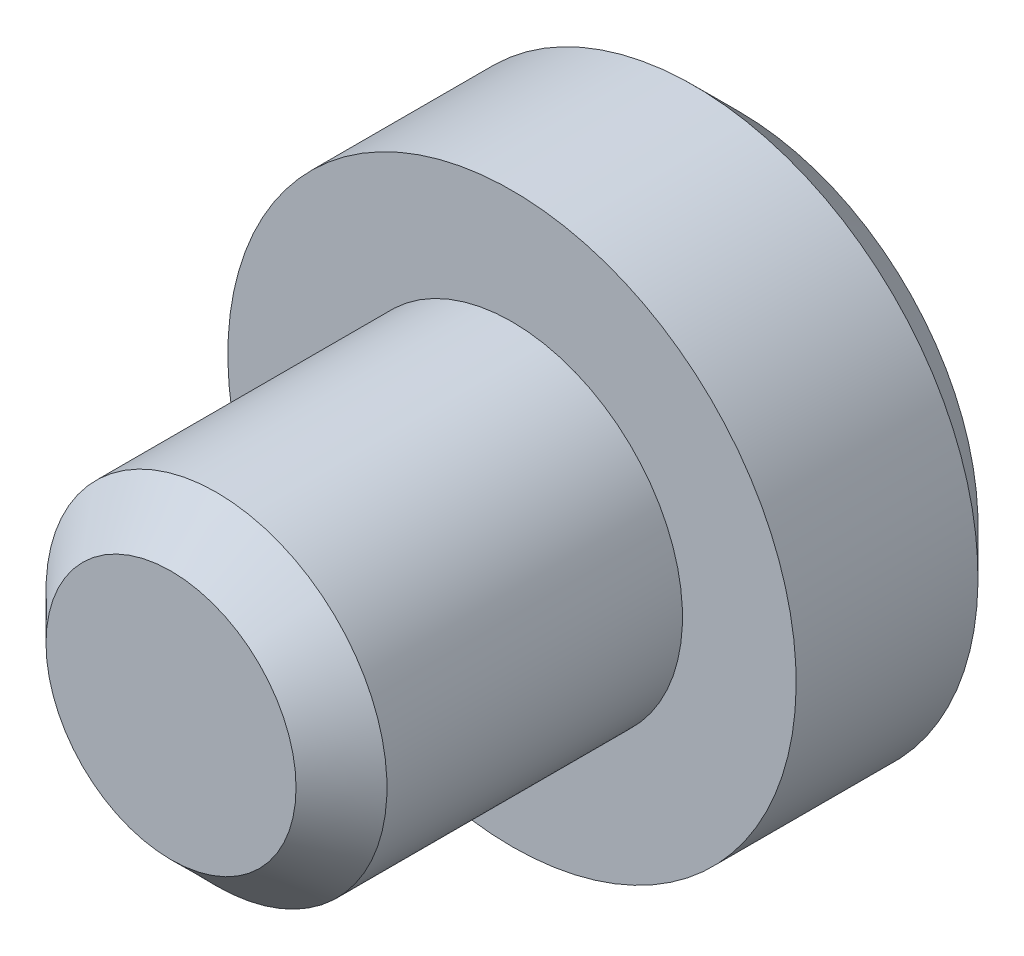
from build123d import *

# Parameters (mm, degrees)
CUT_EXTRUDE1_DEPTH = 2
CHAMFER1_SIZE      = 0.4
CHAMFER2_SIZE      = 0.1


with BuildPart() as part:
    # Sketch2 → Revolve1 (revolve)
    with BuildSketch(Plane(origin=(0, 0, 0), x_dir=(0, 0, -1), z_dir=(1, 0, 0)), mode=Mode.PRIVATE) as revolve1_sk:
        Polygon((0, 2.5), (-2, 2.5), (-2, 1.5), (-5, 1.5), (-5, 0), (0, 0), align=None)
    revolve(revolve1_sk.sketch.rotate(Axis((0, 0, 5), (0, 0, -1)), 180), axis=Axis((0, 0, 5), (0, 0, -1)))

    # Sketch3 → Cut-Extrude1 (cut)
    with BuildSketch(Plane(origin=(0, 0, 0), x_dir=(-1, 0, 0), z_dir=(0, 0, -1))):
        Polygon((1.168445951, -0.498063644), (1.015558744, 0.762872054), (-0.152887207, 1.260935698), (-1.168445951, 0.498063644), (-1.015558744, -0.762872054), (0.152887207, -1.260935698), align=None)
    extrude(amount=-CUT_EXTRUDE1_DEPTH, mode=Mode.SUBTRACT)

    # Chamfer1
    chamfer1_edges = [part.edges().sort_by_distance(p)[0] for p in [
        (0, 1.5, 5),
        (0, 2.5, 0),
    ]]
    chamfer(chamfer1_edges, length=CHAMFER1_SIZE)

    # Chamfer2
    chamfer2_edges = [part.edges().sort_by_distance(p)[0] for p in [
        (-0.660666579, -0.879499671, 0),
        (-1.092002347, 0.132404205, 0),
        (-0.431335769, 1.011903876, 0),
        (0.660666579, 0.879499671, 0),
        (1.092002347, -0.132404205, 0),
        (0.431335769, -1.011903876, 0),
    ]]
    chamfer(chamfer2_edges, length=CHAMFER2_SIZE)


solid = part.part
